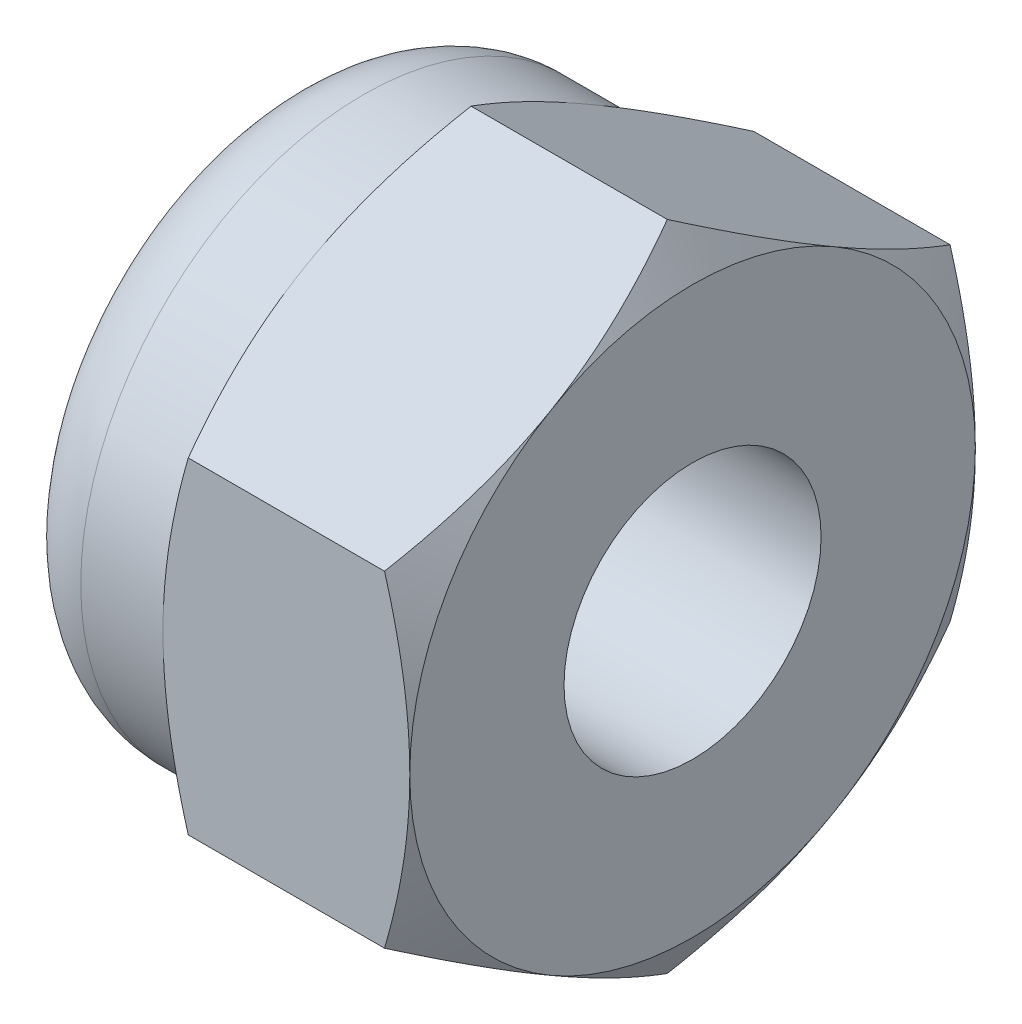
from build123d import *

# Parameters (mm, degrees)
BOSS_EXTRUDE1_DEPTH = 4
SKETCH2_W           = 4
SKETCH2_H           = 1.25


with BuildPart() as part:
    # Sketch1 → Boss-Extrude1 (new body)
    with BuildSketch(Plane(origin=(0, 0, 0), x_dir=(0, 0, -1), z_dir=(1, 0, 0))):
        Polygon((0, 3.175426481), (-2.75, 1.58771324), (-2.75, -1.58771324), (0, -3.175426481), (2.75, -1.58771324), (2.75, 1.58771324), align=None)
    extrude(amount=-BOSS_EXTRUDE1_DEPTH)

    # Sketch2 → Cut-Revolve4 (revolve, cut)
    with BuildSketch(Plane.XY):
        Polygon((0, 2.75), (-0.245620093, 3.175426481), (0, 3.175426481), align=None)
        with BuildLine():
            Line((-2.154379907, 3.175426481), (-2.4, 2.75))
            Line((-2.4, 2.75), (-3.2, 2.75))
            ThreePointArc((-3.2, 2.75), (-3.765685425, 2.515685425), (-4, 1.95))
            Line((-4, 1.95), (-4.425426481, 1.95))
            Line((-4.425426481, 1.95), (-4.425426481, 3.175426481))
            Line((-4.425426481, 3.175426481), (-2.154379907, 3.175426481))
        make_face()
        with Locations((-2, 0.625)):
            Rectangle(SKETCH2_W, SKETCH2_H)
    revolve(axis=Axis((-8.121993413, 0, 0), (1, 0, 0)), mode=Mode.SUBTRACT)


solid = part.part
